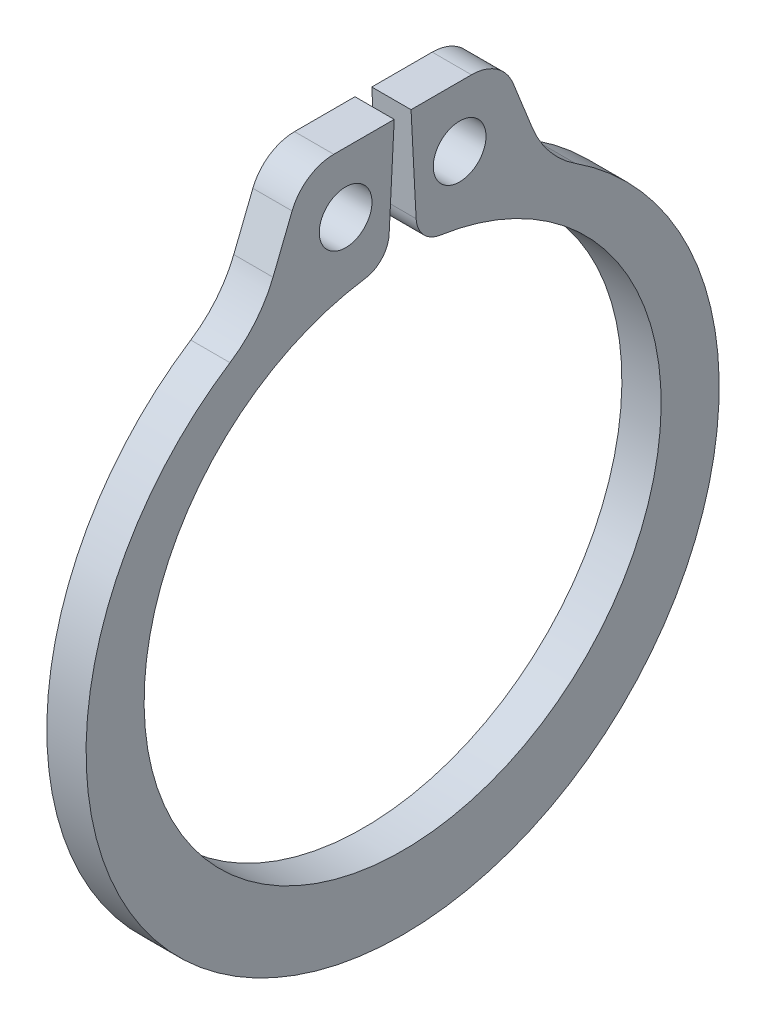
from build123d import *

# Parameters (mm, degrees)
BOSS_EXTRUDE1_DEPTH      = 0.4445
BOSS_EXTRUDE1_DEPTH_BACK = 0.4445
SKETCH3_R                = 0.5969
FILLET1_R                = 2.54
FILLET2_R                = 0.635
FILLET3_R                = 1.016


with BuildPart() as part:
    # Sketch3 → Boss-Extrude1 (new, two sides: drawn at the far end of the back side and taken through both)
    with BuildSketch(Plane(origin=(0, 0, 0), x_dir=(0, 0, -1), z_dir=(1, 0, 0)).offset(-BOSS_EXTRUDE1_DEPTH_BACK)):
        with BuildLine():
            Line((-2.2479, 8.584601843), (-3.258723069, 6.048738914))
            ThreePointArc((-3.258723069, 6.048738914), (0, -7.5057), (3.258723069, 6.048738914))
            Line((3.258723069, 6.048738914), (2.2479, 8.584601843))
            Line((2.2479, 8.584601843), (0.1905, 8.584601843))
            Line((0.1905, 8.584601843), (0.334067995, 5.845161304))
            ThreePointArc((0.334067995, 5.845161304), (0, -5.8547), (-0.334067995, 5.845161304))
            Line((-0.334067995, 5.845161304), (-0.1905, 8.584601843))
            Line((-0.1905, 8.584601843), (-2.2479, 8.584601843))
        make_face()
        with Locations((-1.290983998, 7.214881573)):
            Circle(SKETCH3_R, mode=Mode.SUBTRACT)
        with Locations((1.290983998, 7.214881573)):
            Circle(SKETCH3_R, mode=Mode.SUBTRACT)
    extrude(amount=BOSS_EXTRUDE1_DEPTH + BOSS_EXTRUDE1_DEPTH_BACK)

    # Fillet1
    fillet1_edges = [part.edges().sort_by_distance(p)[0] for p in [
        (0, 6.048738914, 3.258723069),
        (0, 6.048738914, -3.258723069),
    ]]
    fillet(fillet1_edges, radius=FILLET1_R)

    # Fillet2
    fillet2_edges = [part.edges().sort_by_distance(p)[0] for p in [
        (0, 5.845161304, 0.334067995),
        (0, 5.845161304, -0.334067995),
    ]]
    fillet(fillet2_edges, radius=FILLET2_R)

    # Fillet3
    fillet3_edges = [part.edges().sort_by_distance(p)[0] for p in [
        (0, 8.584601843, 2.2479),
        (0, 8.584601843, -2.2479),
    ]]
    fillet(fillet3_edges, radius=FILLET3_R)


solid = part.part
